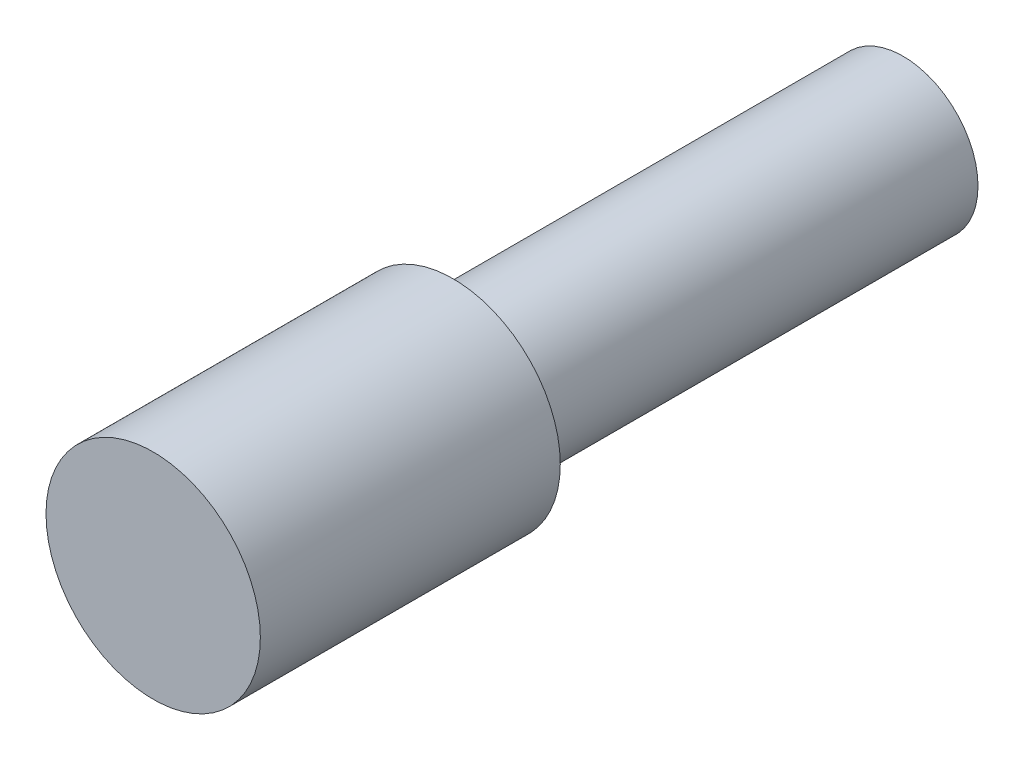
from build123d import *

# Parameters (mm, degrees)
SKETCH_2_R      = 5
EXTRUDE_1_DEPTH = 50
THREAD_1_PITCH  = 1
THREAD_1_HEIGHT = 10
THREAD_1_RADIUS = 5
SKETCH_8_R      = 7.146780715
EXTRUDE_2_DEPTH = 20


with BuildPart() as part:
    # Sketch 2 → Бобышка-Вытянуть1 (new body)
    with BuildSketch(Plane.XY):
        Circle(SKETCH_2_R)
    extrude(amount=EXTRUDE_1_DEPTH)

    # Резьба1: sweep along a helix
    with BuildLine() as thread_1_path:
        Helix(THREAD_1_PITCH, THREAD_1_HEIGHT, THREAD_1_RADIUS, center=(0, 0, 50), direction=(0, 0, -1))
    # Sketch 2 2 → Резьба1 (sweep, cut)
    with BuildSketch(Plane(origin=(-5, 0, 50), x_dir=(-1, 0, 0), z_dir=(0, -1, 0))):
        Polygon((0, 0), (0, 0.874999997), (-0.541265875, 0.562499999), (-0.541265875, 0.312499999), align=None)
    sweep(path=thread_1_path.line, is_frenet=True, mode=Mode.SUBTRACT)

    # Эскиз8 → Бобышка-Вытянуть2 (add)
    with BuildSketch(Plane.XY.offset(50)):
        Circle(SKETCH_8_R)
    extrude(amount=-EXTRUDE_2_DEPTH)


solid = part.part
